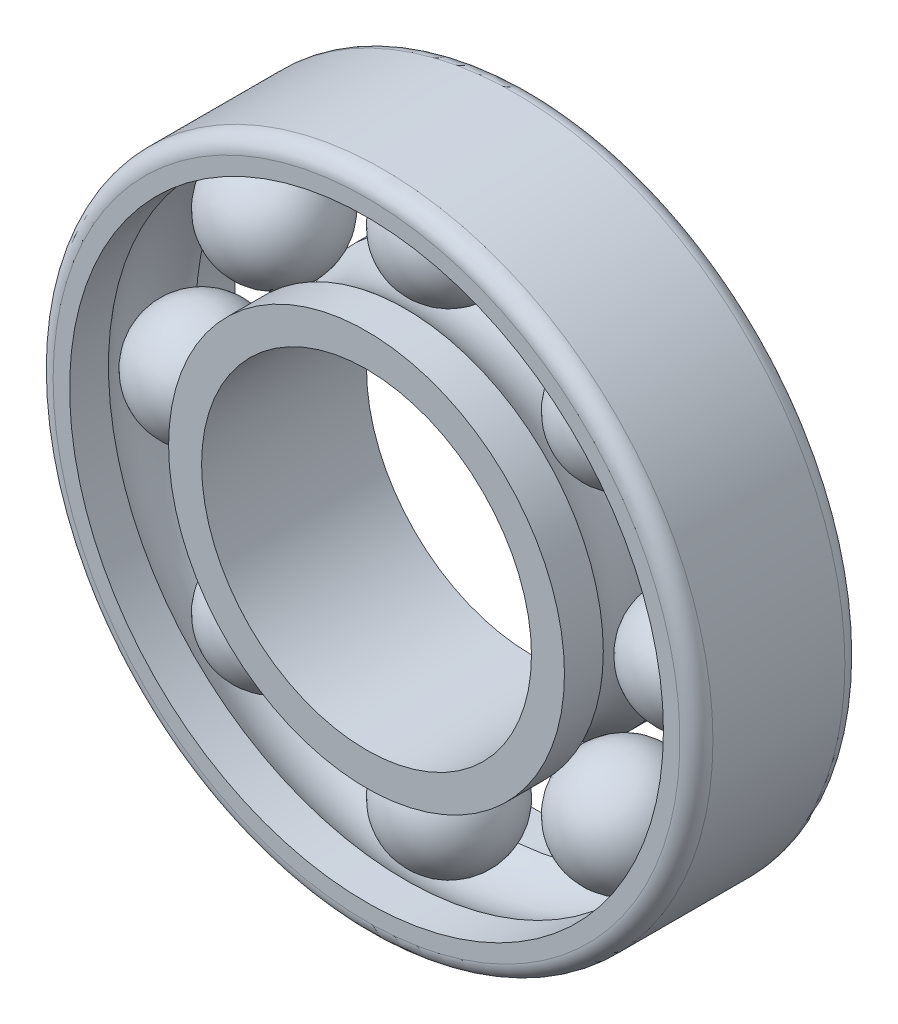
from build123d import *

# Parameters (mm, degrees)
CIRPATTERN1_COUNT = 8
FILLET1_R         = 0.1
FILLET2_R         = 0.1


with BuildPart() as part:
    # Sketch3 → Revolve1 (revolve)
    with BuildSketch(Plane(origin=(0, 0, 0), x_dir=(1, 0, 0), z_dir=(0, 1, 0))):
        with BuildLine():
            Line((-1.5, 0.354562901), (-1.5, -0.354562901))
            ThreePointArc((-1.5, -0.354562901), (-1.145437099, 0), (-1.5, 0.354562901))
        make_face()
    revolve(axis=Axis((-1.5, 0, -0.354562901), (0, 0, 1)))


with BuildPart() as body_2:
    # Sketch2 → Revolve2 (revolve)
    with BuildSketch(Plane(origin=(0, 0, 0), x_dir=(1, 0, 0), z_dir=(0, 1, 0)), mode=Mode.PRIVATE) as revolve2_sk:
        with BuildLine():
            Line((-1, 0.5), (-1.2, 0.5))
            Line((-1.2, 0.5), (-1.2, 0.264575131))
            ThreePointArc((-1.2, 0.264575131), (-1.1, 0), (-1.2, -0.264575131))
            Line((-1.2, -0.264575131), (-1.2, -0.5))
            Line((-1.2, -0.5), (-1, -0.5))
            Line((-1, -0.5), (-1, 0.5))
        make_face()
        with BuildLine():
            Line((-1.8, 0.5), (-2, 0.5))
            Line((-2, 0.5), (-2, -0.5))
            Line((-2, -0.5), (-1.8, -0.5))
            Line((-1.8, -0.5), (-1.8, -0.264575131))
            ThreePointArc((-1.8, -0.264575131), (-1.9, 0), (-1.8, 0.264575131))
            Line((-1.8, 0.264575131), (-1.8, 0.5))
        make_face()
    revolve(revolve2_sk.sketch.rotate(Axis((0, 0, 0), (0, 0, -1)), 180), axis=Axis((0, 0, 0), (0, 0, -1)))

    # Fillet1
    fillet1_edges = [body_2.edges().sort_by_distance(p)[0] for p in [
        (-2, 0, -0.5),
    ]]
    fillet(fillet1_edges, radius=FILLET1_R)

    # Fillet2
    fillet2_edges = [body_2.edges().sort_by_distance(p)[0] for p in [
        (-2, 0, 0.5),
    ]]
    fillet(fillet2_edges, radius=FILLET2_R)


with BuildPart() as cirpattern1_1:
    # CirPattern1: pattern copy
    add(part.part.rotate(Axis((0, 0, 0), (0, 0, 1)), 1 * 360 / CIRPATTERN1_COUNT))


with BuildPart() as cirpattern1_2:
    # CirPattern1: pattern copy
    add(part.part.rotate(Axis((0, 0, 0), (0, 0, 1)), 2 * 360 / CIRPATTERN1_COUNT))


with BuildPart() as cirpattern1_3:
    # CirPattern1: pattern copy
    add(part.part.rotate(Axis((0, 0, 0), (0, 0, 1)), 3 * 360 / CIRPATTERN1_COUNT))


with BuildPart() as cirpattern1_4:
    # CirPattern1: pattern copy
    add(part.part.rotate(Axis((0, 0, 0), (0, 0, 1)), 4 * 360 / CIRPATTERN1_COUNT))


with BuildPart() as cirpattern1_5:
    # CirPattern1: pattern copy
    add(part.part.rotate(Axis((0, 0, 0), (0, 0, 1)), 5 * 360 / CIRPATTERN1_COUNT))


with BuildPart() as cirpattern1_6:
    # CirPattern1: pattern copy
    add(part.part.rotate(Axis((0, 0, 0), (0, 0, 1)), 6 * 360 / CIRPATTERN1_COUNT))


with BuildPart() as cirpattern1_7:
    # CirPattern1: pattern copy
    add(part.part.rotate(Axis((0, 0, 0), (0, 0, 1)), 7 * 360 / CIRPATTERN1_COUNT))


solid = Compound([part.part, body_2.part, cirpattern1_1.part, cirpattern1_2.part, cirpattern1_3.part, cirpattern1_4.part, cirpattern1_5.part, cirpattern1_6.part, cirpattern1_7.part])
